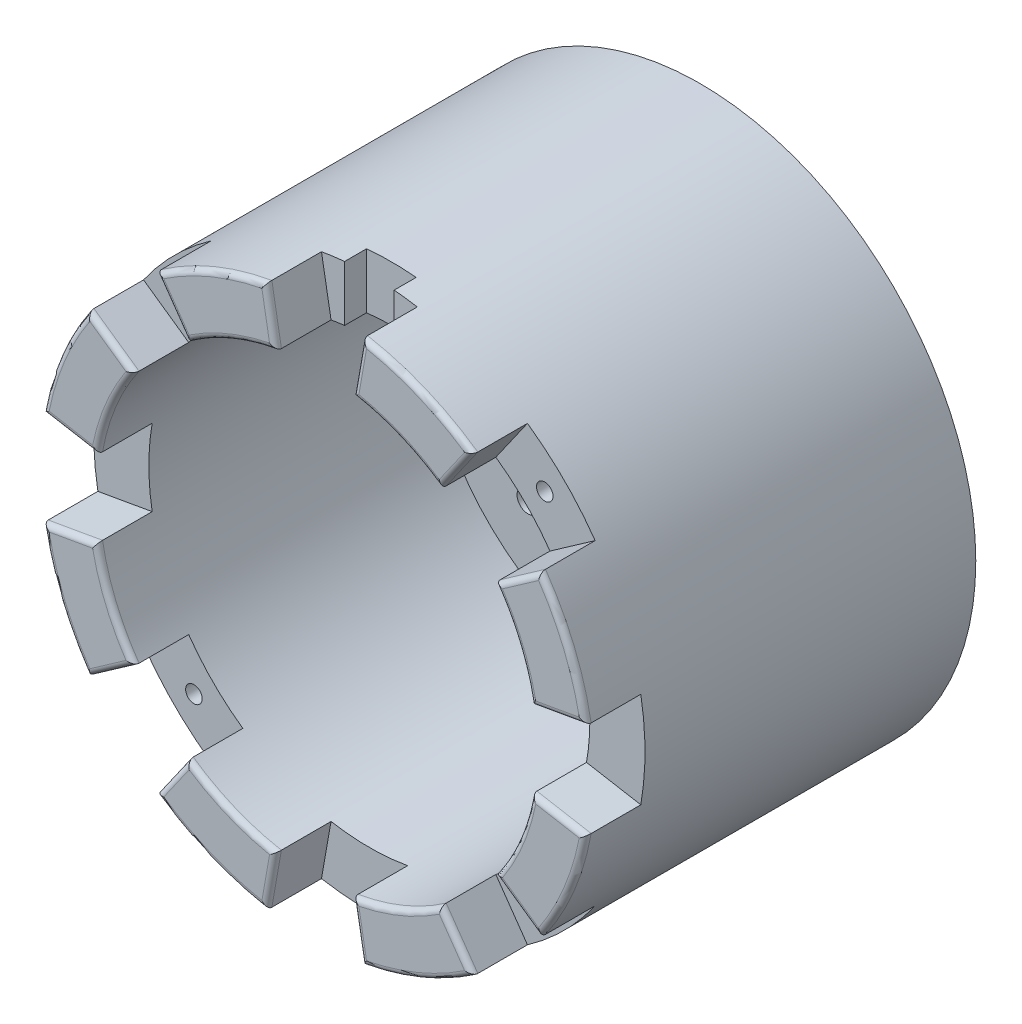
from build123d import *

# Parameters (mm, degrees)
CROQUIS1_R              = 50
CROQUIS1_R_2            = 17.75
SALIENTE_EXTRUIR1_DEPTH = 70
CROQUIS2_R              = 40
CORTAR_EXTRUIR1_DEPTH   = 50
CROQUIS4_R              = 40
CROQUIS4_R_2            = 17.75
CORTAR_EXTRUIR3_DEPTH   = 10
CROQUIS5_R              = 2
CORTAR_EXTRUIR4_DEPTH   = 93.736184955
CROQUIS6_R              = 5
CORTAR_EXTRUIR5_DEPTH   = 5
CORTAR_EXTRUIR6_DEPTH   = 10
REDONDEO2_R             = 1
CORTAR_EXTRUIR7_START   = -10
CROQUIS8_W              = 9
CROQUIS8_H              = 20
CORTAR_EXTRUIR7_DEPTH   = 4
CROQUIS9_R              = 1.5
CORTAR_EXTRUIR8_DEPTH   = 20


with BuildPart() as part:
    # Croquis1 → Saliente-Extruir1 (new body)
    with BuildSketch(Plane.XY):
        Circle(CROQUIS1_R)
        Circle(CROQUIS1_R_2, mode=Mode.SUBTRACT)
    extrude(amount=SALIENTE_EXTRUIR1_DEPTH)

    # Croquis2 → Cortar-Extruir1 (cut)
    with BuildSketch(Plane.XY.offset(70)):
        Circle(CROQUIS2_R)
    extrude(amount=-CORTAR_EXTRUIR1_DEPTH, mode=Mode.SUBTRACT)

    # Croquis4 → Cortar-Extruir3 (cut)
    # profile 1 of 2: a face of its own
    with BuildSketch(Plane.XY.offset(20)):
        Circle(CROQUIS4_R)
        with BuildLine():
            Line((-2.5, 27.386127875), (-2.5, 32.5))
            Line((-2.5, 32.5), (2.5, 32.5))
            Line((2.5, 32.5), (2.5, 27.386127875))
            ThreePointArc((2.5, 27.386127875), (19.445436483, 19.445436483), (27.386127875, 2.5))
            Line((27.386127875, 2.5), (32.5, 2.5))
            Line((32.5, 2.5), (32.5, -2.5))
            Line((32.5, -2.5), (27.386127875, -2.5))
            ThreePointArc((27.386127875, -2.5), (19.445436483, -19.445436483), (2.5, -27.386127875))
            Line((2.5, -27.386127875), (2.5, -32.5))
            Line((2.5, -32.5), (-2.5, -32.5))
            Line((-2.5, -32.5), (-2.5, -27.386127875))
            ThreePointArc((-2.5, -27.386127875), (-19.445436483, -19.445436483), (-27.386127875, -2.5))
            Line((-27.386127875, -2.5), (-32.5, -2.5))
            Line((-32.5, -2.5), (-32.5, 2.5))
            Line((-32.5, 2.5), (-27.386127875, 2.5))
            ThreePointArc((-27.386127875, 2.5), (-19.445436483, 19.445436483), (-2.5, 27.386127875))
        make_face(mode=Mode.SUBTRACT)
    # profile 2 of 2: a face of its own
    with BuildSketch(Plane.XY.offset(20)):
        with BuildLine():
            Line((-2.5, 22.5), (-2.5, 27.386127875))
            ThreePointArc((-2.5, 27.386127875), (-19.445436483, 19.445436483), (-27.386127875, 2.5))
            Line((-27.386127875, 2.5), (-22.5, 2.5))
            Line((-22.5, 2.5), (-22.5, -2.5))
            Line((-22.5, -2.5), (-27.386127875, -2.5))
            ThreePointArc((-27.386127875, -2.5), (-19.445436483, -19.445436483), (-2.5, -27.386127875))
            Line((-2.5, -27.386127875), (-2.5, -22.5))
            Line((-2.5, -22.5), (2.5, -22.5))
            Line((2.5, -22.5), (2.5, -27.386127875))
            ThreePointArc((2.5, -27.386127875), (19.445436483, -19.445436483), (27.386127875, -2.5))
            Line((27.386127875, -2.5), (22.5, -2.5))
            Line((22.5, -2.5), (22.5, 2.5))
            Line((22.5, 2.5), (27.386127875, 2.5))
            ThreePointArc((27.386127875, 2.5), (19.445436483, 19.445436483), (2.5, 27.386127875))
            Line((2.5, 27.386127875), (2.5, 22.5))
            Line((2.5, 22.5), (-2.5, 22.5))
        make_face()
        Circle(CROQUIS4_R_2, mode=Mode.SUBTRACT)
    extrude(amount=-CORTAR_EXTRUIR3_DEPTH, mode=Mode.SUBTRACT)

    # Croquis5 → Cortar-Extruir4 (cut, through all)
    with BuildSketch(Plane.XY.offset(10)):
        with Locations((21.213203436, 21.213203436)):
            Circle(CROQUIS5_R)
        with Locations((21.213203436, -21.213203436)):
            Circle(CROQUIS5_R)
        with Locations((-21.213203436, -21.213203436)):
            Circle(CROQUIS5_R)
        with Locations((-21.213203436, 21.213203436)):
            Circle(CROQUIS5_R)
    extrude(amount=-CORTAR_EXTRUIR4_DEPTH, mode=Mode.SUBTRACT)

    # Croquis6 → Cortar-Extruir5 (cut)
    with BuildSketch(Plane(origin=(0, 0, 0), x_dir=(-1, 0, 0), z_dir=(0, 0, -1))):
        with Locations((-21.213203436, 21.213203436)):
            Circle(CROQUIS6_R)
        with Locations((21.486974797, 21.486974797)):
            Circle(CROQUIS6_R)
        with Locations((21.760746158, -21.213203436)):
            Circle(CROQUIS6_R)
        with Locations((-20.939432074, -21.486974797)):
            Circle(CROQUIS6_R)
    extrude(amount=-CORTAR_EXTRUIR5_DEPTH, mode=Mode.SUBTRACT)

    # Croquis7 → Cortar-Extruir6 (cut)
    with BuildSketch(Plane.XY.offset(70)):
        with BuildLine():
            ThreePointArc((-6.945927107, 39.39231012), (-3.48622971, 39.847787924), (0, 40))
            Line((0, 40), (0, 50))
            ThreePointArc((0, 50), (-4.357787137, 49.809734905), (-8.682408883, 49.240387651))
            Line((-8.682408883, 49.240387651), (-6.945927107, 39.39231012))
        make_face()
        with BuildLine():
            Line((0, 50), (0, 40))
            ThreePointArc((0, 40), (3.48622971, 39.847787924), (6.945927107, 39.39231012))
            Line((6.945927107, 39.39231012), (8.682408883, 49.240387651))
            ThreePointArc((8.682408883, 49.240387651), (4.357787137, 49.809734905), (0, 50))
        make_face()
        with BuildLine():
            ThreePointArc((22.943057454, 32.766081772), (28.284271247, 28.284271247), (32.766081772, 22.943057454))
            Line((32.766081772, 22.943057454), (40.957602214, 28.678821818))
            ThreePointArc((40.957602214, 28.678821818), (35.355339059, 35.355339059), (28.678821818, 40.957602214))
            Line((28.678821818, 40.957602214), (22.943057454, 32.766081772))
        make_face()
        with BuildLine():
            ThreePointArc((40, 0), (39.847787924, -3.48622971), (39.39231012, -6.945927107))
            Line((39.39231012, -6.945927107), (49.240387651, -8.682408883))
            ThreePointArc((49.240387651, -8.682408883), (49.809734905, -4.357787137), (50, 0))
            ThreePointArc((50, 0), (49.809734905, 4.357787137), (49.240387651, 8.682408883))
            Line((49.240387651, 8.682408883), (39.39231012, 6.945927107))
            ThreePointArc((39.39231012, 6.945927107), (39.847787924, 3.48622971), (40, 0))
        make_face()
        with BuildLine():
            ThreePointArc((32.766081772, -22.943057454), (28.284271247, -28.284271247), (22.943057454, -32.766081772))
            Line((22.943057454, -32.766081772), (28.678821818, -40.957602214))
            ThreePointArc((28.678821818, -40.957602214), (35.355339059, -35.355339059), (40.957602214, -28.678821818))
            Line((40.957602214, -28.678821818), (32.766081772, -22.943057454))
        make_face()
        with BuildLine():
            ThreePointArc((-32.766081772, 22.943057454), (-28.284271247, 28.284271247), (-22.943057454, 32.766081772))
            Line((-22.943057454, 32.766081772), (-28.678821818, 40.957602214))
            ThreePointArc((-28.678821818, 40.957602214), (-35.355339059, 35.355339059), (-40.957602214, 28.678821818))
            Line((-40.957602214, 28.678821818), (-32.766081772, 22.943057454))
        make_face()
        with BuildLine():
            ThreePointArc((-39.39231012, -6.945927107), (-40, 0), (-39.39231012, 6.945927107))
            Line((-39.39231012, 6.945927107), (-49.240387651, 8.682408883))
            ThreePointArc((-49.240387651, 8.682408883), (-50, 0), (-49.240387651, -8.682408883))
            Line((-49.240387651, -8.682408883), (-39.39231012, -6.945927107))
        make_face()
        with BuildLine():
            ThreePointArc((-22.943057454, -32.766081772), (-28.284271247, -28.284271247), (-32.766081772, -22.943057454))
            Line((-32.766081772, -22.943057454), (-40.957602214, -28.678821818))
            ThreePointArc((-40.957602214, -28.678821818), (-35.355339059, -35.355339059), (-28.678821818, -40.957602214))
            Line((-28.678821818, -40.957602214), (-22.943057454, -32.766081772))
        make_face()
        with BuildLine():
            ThreePointArc((6.945927107, -39.39231012), (0, -40), (-6.945927107, -39.39231012))
            Line((-6.945927107, -39.39231012), (-8.682408883, -49.240387651))
            ThreePointArc((-8.682408883, -49.240387651), (0, -50), (8.682408883, -49.240387651))
            Line((8.682408883, -49.240387651), (6.945927107, -39.39231012))
        make_face()
    extrude(amount=-CORTAR_EXTRUIR6_DEPTH, mode=Mode.SUBTRACT)

    # Redondeo2
    redondeo2_edges = [part.edges().sort_by_distance(p)[0] for p in [
        (36.9551813, 15.307337295, 70),
        (15.307337295, 36.9551813, 70),
        (-15.307337295, 36.9551813, 70),
        (-36.9551813, 15.307337295, 70),
        (-36.9551813, -15.307337295, 70),
        (-15.307337295, -36.9551813, 70),
        (15.307337295, -36.9551813, 70),
        (36.9551813, -15.307337295, 70),
        (19.134171618, 46.193976626, 70),
        (-19.134171618, 46.193976626, 70),
        (-46.193976626, 19.134171618, 70),
        (-46.193976626, -19.134171618, 70),
        (-19.134171618, -46.193976626, 70),
        (19.134171618, -46.193976626, 70),
        (46.193976626, -19.134171618, 70),
        (-36.861841993, 25.810939636, 70),
        (-25.810939636, 36.861841993, 70),
        (36.861841993, -25.810939636, 70),
        (25.810939636, -36.861841993, 70),
        (44.316348886, 7.814167995, 70),
        (44.316348886, -7.814167995, 70),
        (25.810939636, 36.861841993, 70),
        (36.861841993, 25.810939636, 70),
        (-44.316348886, -7.814167995, 70),
        (-44.316348886, 7.814167995, 70),
        (-25.810939636, -36.861841993, 70),
        (-36.861841993, -25.810939636, 70),
        (7.814167995, -44.316348886, 70),
        (-7.814167995, -44.316348886, 70),
        (-7.814167995, 44.316348886, 70),
        (7.814167995, 44.316348886, 70),
        (-22.5, 0, 20),
        (2.5, -27.5, 20),
        (32.5, 0, 20),
        (27.5, 2.5, 20),
        (-2.5, 27.5, 20),
        (-27.5, -2.5, 20),
        (0, -22.5, 20),
        (0, 22.5, 20),
        (2.5, 27.5, 20),
        (0, 32.5, 20),
        (27.5, -2.5, 20),
        (22.5, 0, 20),
        (-2.5, -27.5, 20),
        (0, -32.5, 20),
        (-32.5, 0, 20),
        (-27.5, 2.5, 20),
        (46.193976626, 19.134171618, 70),
    ]]
    fillet(redondeo2_edges, radius=REDONDEO2_R)

    # Croquis8 → Cortar-Extruir7 (cut)
    with BuildSketch(Plane.XY.offset(70).offset(CORTAR_EXTRUIR7_START)):
        with Locations((0, 45)):
            Rectangle(CROQUIS8_W, CROQUIS8_H)
    extrude(amount=-CORTAR_EXTRUIR7_DEPTH, mode=Mode.SUBTRACT)

    # Croquis9 → Cortar-Extruir8 (cut)
    with BuildSketch(Plane.XY.offset(60)):
        with Locations((31.819805153, 31.819805153)):
            Circle(CROQUIS9_R)
        with Locations((31.819805153, -31.819805153)):
            Circle(CROQUIS9_R)
        with Locations((-31.819805153, -31.819805153)):
            Circle(CROQUIS9_R)
        with Locations((-31.819805153, 31.819805153)):
            Circle(CROQUIS9_R)
    extrude(amount=-CORTAR_EXTRUIR8_DEPTH, mode=Mode.SUBTRACT)


solid = part.part
